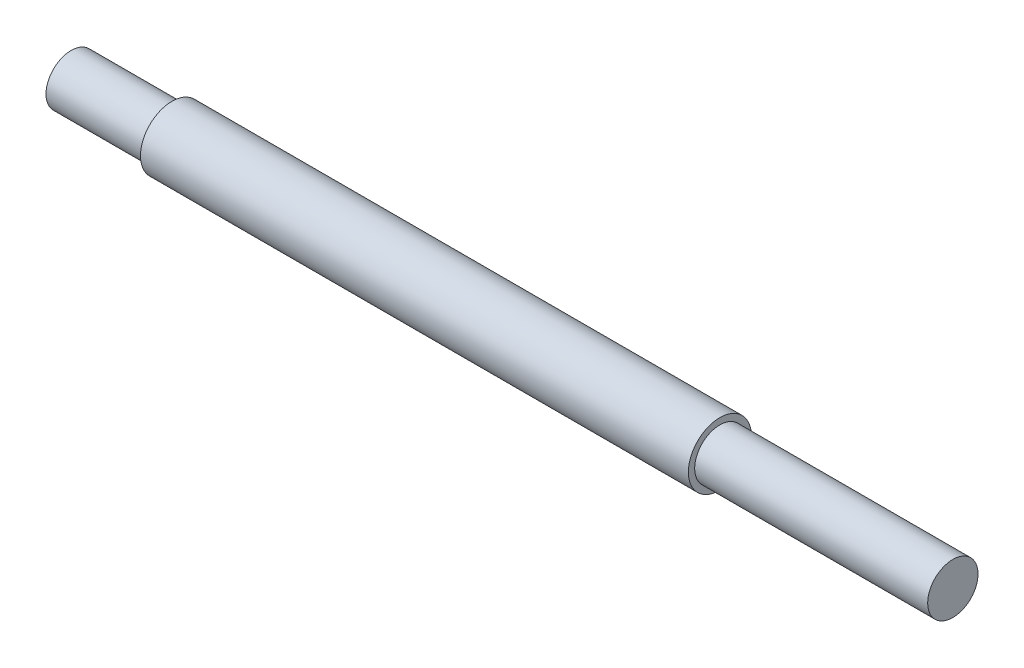
from build123d import *


with BuildPart() as part:
    # Sketch1 → Revolve1 (revolve)
    with BuildSketch(Plane(origin=(0, 0, 0), x_dir=(1, 0, 0), z_dir=(0, 1, 0)), mode=Mode.PRIVATE) as revolve1_sk:
        Polygon((0, 0), (35, 0), (35, 1), (25.75, 1), (25.75, 1.25), (4, 1.25), (4, 1), (0, 1), align=None)
    revolve(revolve1_sk.sketch.rotate(Axis((0, 0, 0), (1, 0, 0)), 180), axis=Axis((0, 0, 0), (1, 0, 0)))


solid = part.part
